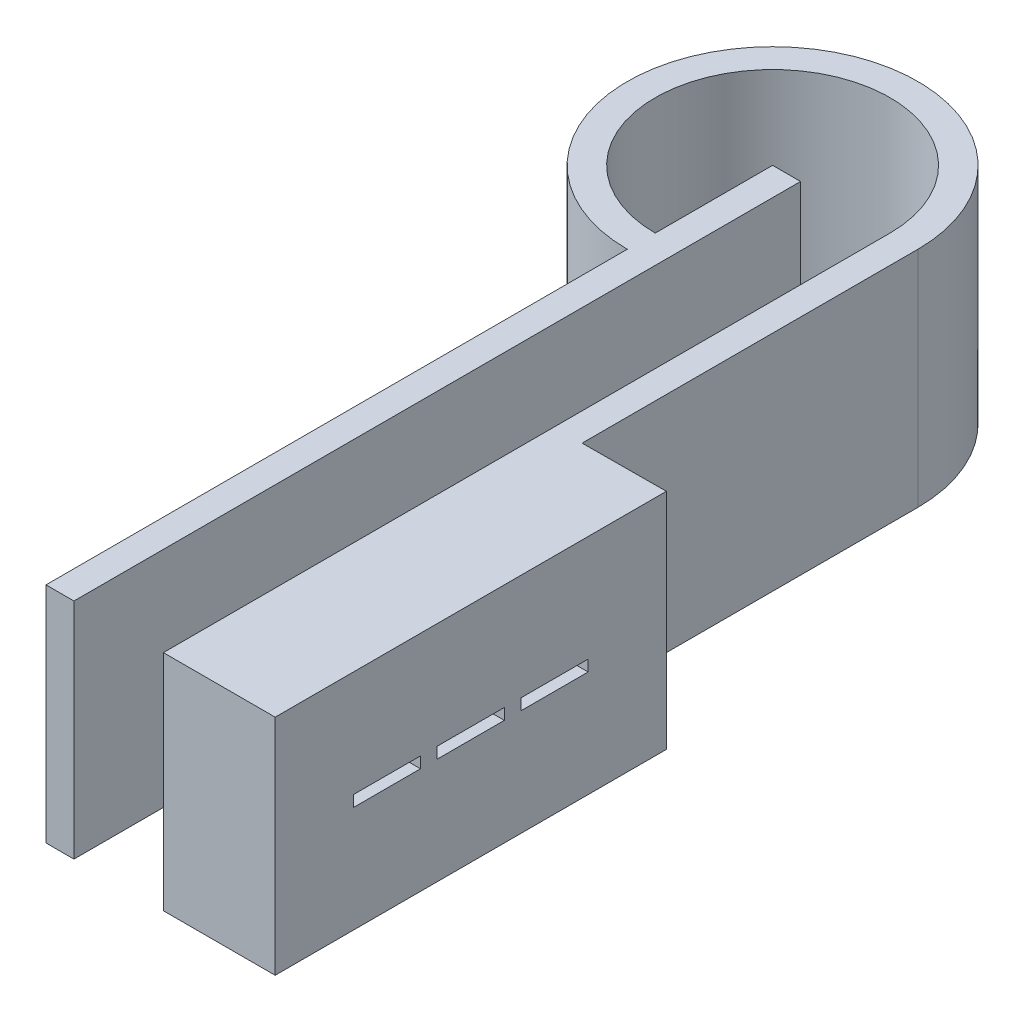
from build123d import *

# Parameters (mm, degrees)
BOSS_EXTRUDE1_DEPTH = 20
SKETCH2_R           = 4
CUT_EXTRUDE2_DEPTH  = 8
CUT_EXTRUDE4_DEPTH  = 10
SKETCH4_R           = 2.6
CUT_EXTRUDE5_DEPTH  = 1.5
SKETCH6_W           = 2.5
SKETCH6_H           = 20
SKETCH6_W_2         = 10
BOSS_EXTRUDE3_DEPTH = 5


with BuildPart() as part:
    # Sketch1 → Boss-Extrude1 (new body)
    with BuildSketch(Plane(origin=(0, 0, 0), x_dir=(1, 0, 0), z_dir=(0, 1, 0))):
        with BuildLine():
            Line((-30.801242739, -7.293134051), (-30.801242739, 22.74889672))
            ThreePointArc((-30.801242739, 22.74889672), (-52.993630894, 31.941284876), (-43.801242739, 9.74889672))
            Line((-43.801242739, 9.74889672), (-43.801242739, -37.25110328))
            Line((-43.801242739, -37.25110328), (-41.301242739, -37.25110328))
            Line((-41.301242739, -37.25110328), (-41.301242739, 22.74889672))
            Line((-41.301242739, 22.74889672), (-43.801242739, 22.74889672))
            Line((-43.801242739, 22.74889672), (-43.801242739, 12.24889672))
            ThreePointArc((-43.801242739, 12.24889672), (-51.225863941, 30.173517923), (-33.301242739, 22.74889672))
            Line((-33.301242739, 22.74889672), (-33.301242739, -37.25110328))
            Line((-33.301242739, -37.25110328), (-23.301242739, -37.25110328))
            Line((-23.301242739, -37.25110328), (-23.301242739, -7.25110328))
            Line((-23.301242739, -7.25110328), (-30.801242739, -7.293134051))
        make_face()
    extrude(amount=BOSS_EXTRUDE1_DEPTH)

    # Sketch2 → Cut-Extrude2 (cut)
    with BuildSketch(Plane.ZY.offset(33.301242739)):
        with Locations((17.25110328, 10)):
            Circle(SKETCH2_R)
        with Locations((32.25110328, 10)):
            Circle(SKETCH2_R)
    extrude(amount=-CUT_EXTRUDE2_DEPTH, mode=Mode.SUBTRACT)

    # Sketch3 → Cut-Extrude4 (cut)
    with BuildSketch(Plane(origin=(-23.301242739, 0, 0), x_dir=(0, 0, -1), z_dir=(1, 0, 0))):
        Polygon((-24.75110328, 10), (-27.75110328, 10.5), (-27.75110328, 9.5), align=None)
        Polygon((-21.75110328, 10.5), (-27.75110328, 10.5), (-24.75110328, 10), align=None)
        Polygon((-21.75110328, 10.5), (-24.75110328, 10), (-21.75110328, 9.5), align=None)
        Polygon((-21.75110328, 9.5), (-24.75110328, 10), (-27.75110328, 9.5), align=None)
        Polygon((-17.25110328, 10), (-20.25110328, 10.5), (-20.25110328, 9.5), align=None)
        Polygon((-14.25110328, 10.5), (-17.25110328, 10), (-14.25110328, 9.5), align=None)
        Polygon((-14.25110328, 10.5), (-20.25110328, 10.5), (-17.25110328, 10), align=None)
        Polygon((-14.25110328, 9.5), (-17.25110328, 10), (-20.25110328, 9.5), align=None)
        Polygon((-29.25110328, 10.5), (-32.25110328, 10), (-29.25110328, 9.5), align=None)
        Polygon((-29.25110328, 10.5), (-35.25110328, 10.5), (-32.25110328, 10), align=None)
        Polygon((-32.25110328, 10), (-35.25110328, 10.5), (-35.25110328, 9.5), align=None)
        Polygon((-29.25110328, 9.5), (-32.25110328, 10), (-35.25110328, 9.5), align=None)
    extrude(amount=-CUT_EXTRUDE4_DEPTH, mode=Mode.SUBTRACT)

    # Sketch4 → Cut-Extrude5 (cut)
    with BuildSketch(Plane.ZY.offset(33.301242739)):
        with Locations((24.75110328, 10)):
            Circle(SKETCH4_R)
    extrude(amount=-CUT_EXTRUDE5_DEPTH, mode=Mode.SUBTRACT)

    # Sketch6 → Boss-Extrude3 (add)
    with BuildSketch(Plane.XY.offset(37.25110328)):
        with Locations((-42.551242739, 10)):
            Rectangle(SKETCH6_W, SKETCH6_H)
        with Locations((-28.301242739, 10)):
            Rectangle(SKETCH6_W_2, SKETCH6_H)
    extrude(amount=BOSS_EXTRUDE3_DEPTH)


solid = part.part
